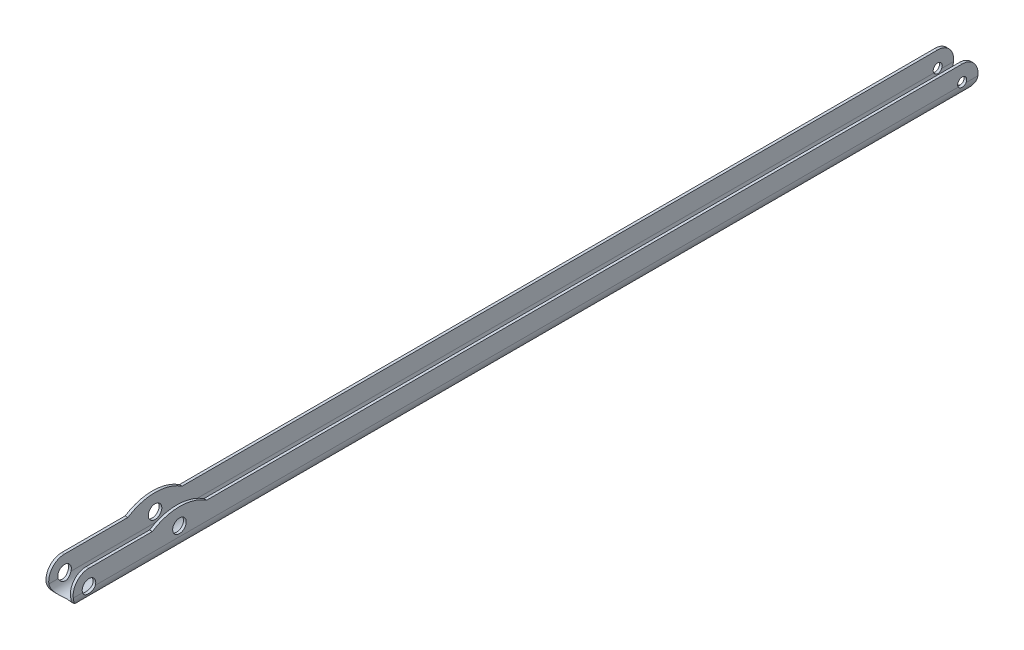
from build123d import *

# Parameters (mm, degrees)
ESTRUSIONE_ESTRUSIONE1_DEPTH = 100
SCHIZZO2_R                   = 0.75
SCHIZZO2_R_2                 = 0.5
TAGLIO_ESTRUSIONE5_DEPTH     = 100
ESTRUSIONE_ESTRUSIONE2_DEPTH = 0.3
ESTRUSIONE_ESTRUSIONE3_START = -0.3
ESTRUSIONE_ESTRUSIONE3_DEPTH = 0.3


with BuildPart() as part:
    # Schizzo1 → Estrusione-Estrusione1 (new body)
    with BuildSketch(Plane.XY):
        with BuildLine():
            Line((-1.5, -18), (-1.2, -18))
            Line((-1.2, -18), (-1.2, -20))
            ThreePointArc((-1.2, -20), (0, -21.2), (1.2, -20))
            Line((1.2, -20), (1.2, -18))
            Line((1.2, -18), (1.5, -18))
            Line((1.5, -18), (1.5, -20))
            ThreePointArc((1.5, -20), (0, -21.5), (-1.5, -20))
            Line((-1.5, -20), (-1.5, -18))
        make_face()
    extrude(amount=ESTRUSIONE_ESTRUSIONE1_DEPTH)

    # Schizzo2 → Taglio-Estrusione5 (cut)
    with BuildSketch(Plane(origin=(1.5, 0, 0), x_dir=(0, 0, -1), z_dir=(1, 0, 0))):
        with Locations(Location((-98.25, -19.75, 0), (0, 0, 340.528779366))):
            Circle(SCHIZZO2_R)
        with Locations(Location((-88.25, -18.95, 0), (0, 0, 90))):
            Circle(SCHIZZO2_R)
        with Locations(Location((-1.75, -19.75, 0), (0, 0, 330))):
            Circle(SCHIZZO2_R_2)
        with BuildLine():
            Line((-98.25, -18), (-98.25, -16.563576213))
            Line((-98.25, -16.563576213), (-100.988318438, -16.563576213))
            Line((-100.988318438, -16.563576213), (-100.988318438, -22.305317171))
            Line((-100.988318438, -22.305317171), (-98.25, -22.305317171))
            Line((-98.25, -22.305317171), (-98.25, -21.5))
            ThreePointArc((-98.25, -21.5), (-100, -19.75), (-98.25, -18))
        make_face()
        with BuildLine():
            Line((-1.75, -18), (-1.75, -17.014244045))
            Line((-1.75, -17.014244045), (0.783864607, -17.014244045))
            Line((0.783864607, -17.014244045), (0.783864607, -22.108114786))
            Line((0.783864607, -22.108114786), (-1.75, -22.108114786))
            Line((-1.75, -22.108114786), (-1.75, -21.5))
            ThreePointArc((-1.75, -21.5), (0, -19.75), (-1.75, -18))
        make_face()
    extrude(amount=-TAGLIO_ESTRUSIONE5_DEPTH, mode=Mode.SUBTRACT)

    # Schizzo3 → Estrusione-Estrusione2 (add)
    with BuildSketch(Plane(origin=(1.5, 0, 0), x_dir=(0, 0, -1), z_dir=(1, 0, 0))):
        with BuildLine():
            Line((-91.25, -18), (-85.25, -18))
            ThreePointArc((-85.25, -18), (-88.25, -17.109772229), (-91.25, -18))
        make_face()
    extrude(amount=-ESTRUSIONE_ESTRUSIONE2_DEPTH)

    # Schizzo4 → Estrusione-Estrusione3 (add)
    with BuildSketch(Plane.ZY.offset(1.5).offset(ESTRUSIONE_ESTRUSIONE3_START)):
        with BuildLine():
            Line((91.25, -18), (85.25, -18))
            ThreePointArc((85.25, -18), (88.25, -17.109772229), (91.25, -18))
        make_face()
    extrude(amount=ESTRUSIONE_ESTRUSIONE3_DEPTH)


solid = part.part
